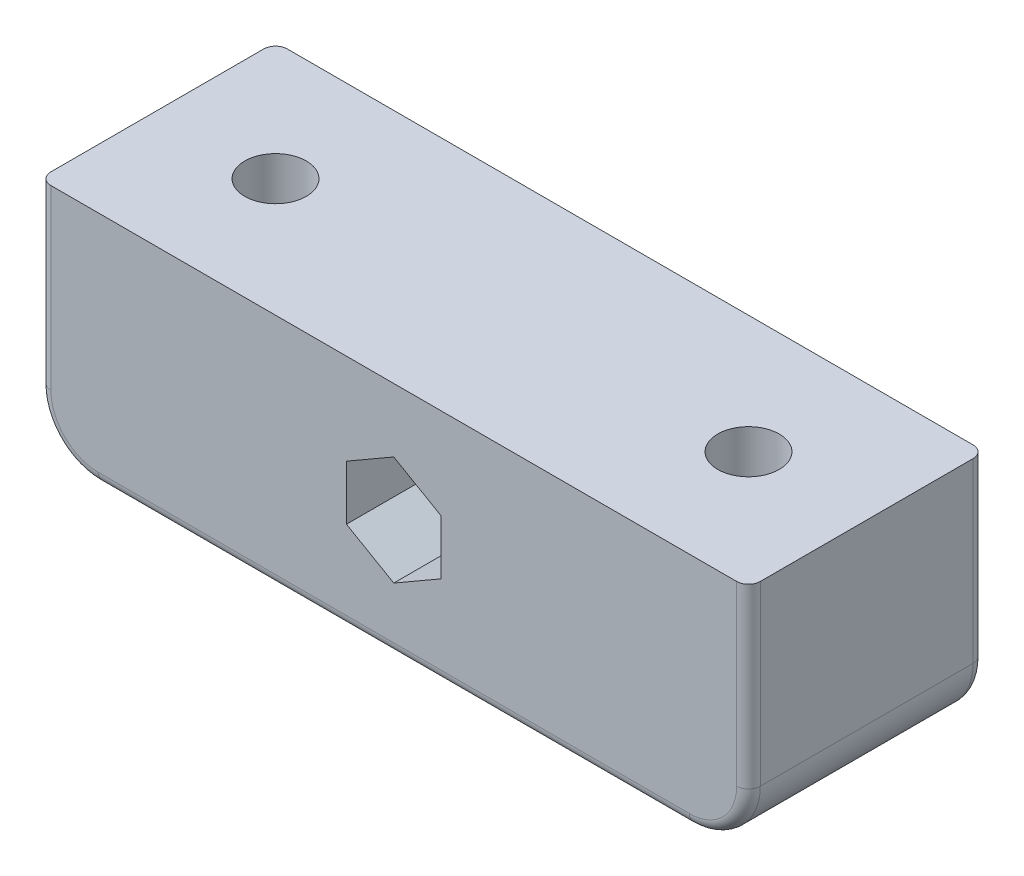
from build123d import *

# Parameters (mm, degrees)
SKETCH1_R           = 2.6
BOSS_EXTRUDE1_DEPTH = 20
SKETCH2_R           = 2.6
CUT_EXTRUDE1_DEPTH  = 20
CUT_EXTRUDE2_DEPTH  = 3
CUT_EXTRUDE3_DEPTH  = 8
FILLET1_R           = 1


with BuildPart() as part:
    # Sketch1 → Boss-Extrude1 (new body)
    with BuildSketch(Plane.XY):
        with BuildLine():
            Line((-30, 0), (30, 0))
            Line((30, 0), (30, -15))
            ThreePointArc((30, -15), (28.535533906, -18.535533906), (25, -20))
            Line((25, -20), (-25, -20))
            ThreePointArc((-25, -20), (-28.535533906, -18.535533906), (-30, -15))
            Line((-30, -15), (-30, 0))
        make_face()
        with Locations((0, -10)):
            Circle(SKETCH1_R, mode=Mode.SUBTRACT)
    extrude(amount=BOSS_EXTRUDE1_DEPTH)

    # Sketch2 → Cut-Extrude1 (cut)
    with BuildSketch(Plane(origin=(0, 0, 0), x_dir=(1, 0, 0), z_dir=(0, 1, 0))):
        with Locations(Location((-20, -10, 0), (0, 0, 180))):
            Circle(SKETCH2_R)
        with Locations(Location((20, -10, 0), (0, 0, 180))):
            Circle(SKETCH2_R)
    extrude(amount=-CUT_EXTRUDE1_DEPTH, mode=Mode.SUBTRACT)

    # Sketch3 → Cut-Extrude2 (cut)
    with BuildSketch(Plane(origin=(0, 0, 0), x_dir=(-1, 0, 0), z_dir=(0, 0, -1))):
        Polygon((6.062177826, -10), (3.031088913, -4.75), (-3.031088913, -4.75), (-6.062177826, -10), (-3.031088913, -15.25), (3.031088913, -15.25), align=None)
    extrude(amount=-CUT_EXTRUDE2_DEPTH, mode=Mode.SUBTRACT)

    # Sketch4 → Cut-Extrude3 (cut)
    with BuildSketch(Plane.XY.offset(20)):
        Polygon((-4, -7.690598923), (-4, -12.309401077), (0, -14.618802154), (4, -12.309401077), (4, -7.690598923), (0, -5.381197846), align=None)
    extrude(amount=-CUT_EXTRUDE3_DEPTH, mode=Mode.SUBTRACT)

    # Fillet1
    fillet1_edges = [part.edges().sort_by_distance(p)[0] for p in [
        (0, -20, 20),
        (28.535533906, -18.535533906, 20),
        (30, -7.5, 20),
        (-30, -7.5, 20),
        (30, -7.5, 0),
        (28.535533906, -18.535533906, 0),
        (-28.535533906, -18.535533906, 20),
        (0, -20, 0),
        (-28.535533906, -18.535533906, 0),
        (-30, -7.5, 0),
    ]]
    fillet(fillet1_edges, radius=FILLET1_R)


solid = part.part
